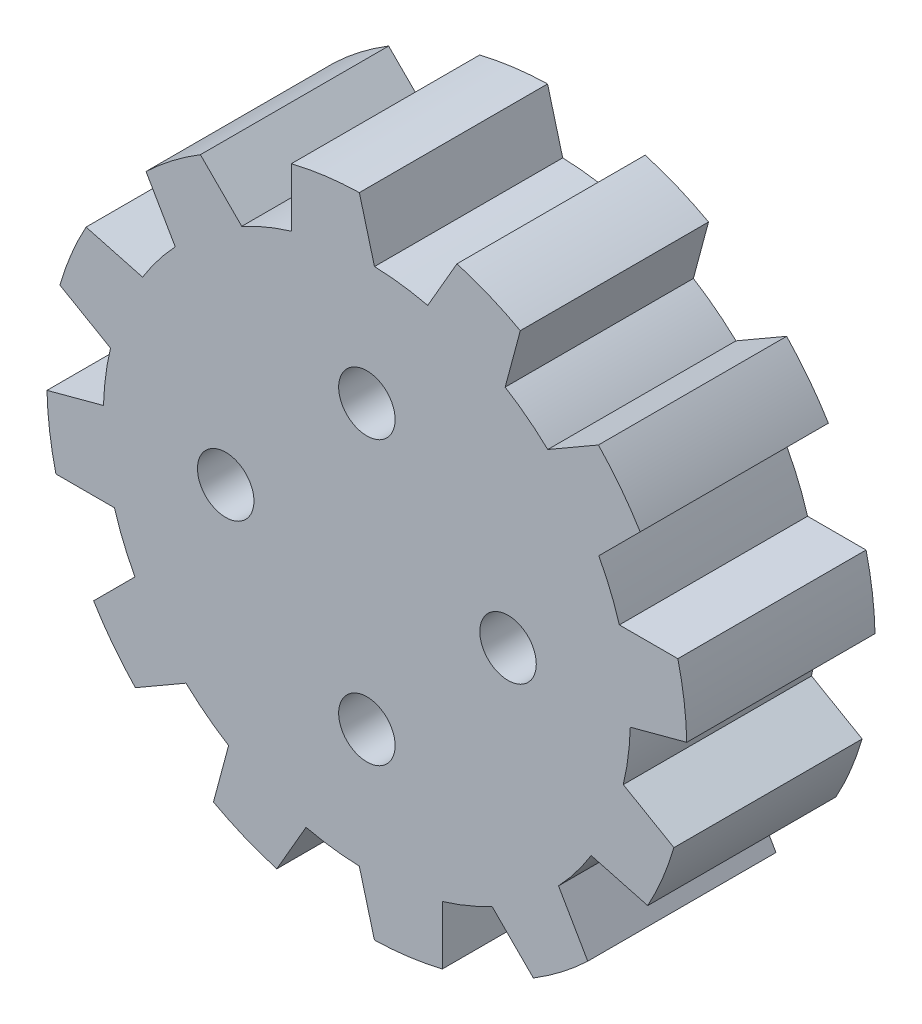
from build123d import *

# Parameters (mm, degrees)
SKETCH_1_R          = 14
EXTRUDE_2_DEPTH     = 10
SKETCH_2_R          = 10.75
CUT_EXTRUDE_1_DEPTH = 4
SKETCH_3_R          = 1.5
CUT_EXTRUDE_2_DEPTH = 10
SKETCH_4_R          = 3.75
CUT_EXTRUDE_3_DEPTH = 1


with BuildPart() as part:
    # 草圖1 → 填料-伸長2 (new body)
    with BuildSketch(Plane.XY):
        Circle(SKETCH_1_R)
        with BuildLine():
            Line((-4.011695199, 16.519875957), (-4.011695199, 13.412915478))
            ThreePointArc((-4.011695199, 13.412915478), (-1.827366691, 13.880228059), (0.403482024, 13.994184587))
            Line((0.403482024, 13.994184587), (-0.40065852, 16.995277954))
            ThreePointArc((-0.40065852, 16.995277954), (-2.218945268, 16.854562643), (-4.011695199, 16.519875957))
        make_face()
        with BuildLine():
            Line((4.785708024, 16.312479846), (3.232227785, 13.621773143))
            ThreePointArc((3.232227785, 13.621773143), (5.357568053, 12.934313455), (7.346517976, 11.917578346))
            Line((7.346517976, 11.917578346), (8.15065852, 14.918671713))
            ThreePointArc((8.15065852, 14.918671713), (6.50561835, 15.705952053), (4.785708024, 16.312479846))
        make_face()
        with BuildLine():
            Line((12.300784646, 11.734167933), (9.610077944, 10.180687694))
            ThreePointArc((9.610077944, 10.180687694), (11.106946764, 8.522660006), (12.32106037, 6.647666611))
            Line((12.32106037, 6.647666611), (14.518013193, 8.844619434))
            ThreePointArc((14.518013193, 8.844619434), (13.487006785, 10.348944293), (12.300784646, 11.734167933))
        make_face()
        with BuildLine():
            Line((16.519875957, 4.011695199), (13.412915478, 4.011695199))
            ThreePointArc((13.412915478, 4.011695199), (13.852451348, 2.027212779), (14, 0))
            ThreePointArc((14, 0), (13.998546071, -0.201761965), (13.994184587, -0.403482024))
            Line((13.994184587, -0.403482024), (16.995277954, 0.40065852))
            ThreePointArc((16.995277954, 0.40065852), (16.854562643, 2.218945268), (16.519875957, 4.011695199))
        make_face()
        with BuildLine():
            Line((16.312479846, -4.785708024), (13.621773143, -3.232227785))
            ThreePointArc((13.621773143, -3.232227785), (12.934313455, -5.357568053), (11.917578346, -7.346517976))
            Line((11.917578346, -7.346517976), (14.918671713, -8.15065852))
            ThreePointArc((14.918671713, -8.15065852), (15.705952053, -6.50561835), (16.312479846, -4.785708024))
        make_face()
        with BuildLine():
            ThreePointArc((10.180687694, -9.610077944), (8.522660006, -11.106946764), (6.647666611, -12.32106037))
            Line((6.647666611, -12.32106037), (8.844619434, -14.518013193))
            ThreePointArc((8.844619434, -14.518013193), (10.348944293, -13.487006785), (11.734167933, -12.300784646))
            Line((11.734167933, -12.300784646), (10.180687694, -9.610077944))
        make_face()
        with BuildLine():
            ThreePointArc((4.011695199, -13.412915478), (1.827366691, -13.880228059), (-0.403482024, -13.994184587))
            Line((-0.403482024, -13.994184587), (0.40065852, -16.995277954))
            ThreePointArc((0.40065852, -16.995277954), (2.218945268, -16.854562643), (4.011695199, -16.519875957))
            Line((4.011695199, -16.519875957), (4.011695199, -13.412915478))
        make_face()
        with BuildLine():
            ThreePointArc((-3.232227785, -13.621773143), (-5.357568053, -12.934313455), (-7.346517976, -11.917578346))
            Line((-7.346517976, -11.917578346), (-8.15065852, -14.918671713))
            ThreePointArc((-8.15065852, -14.918671713), (-6.50561835, -15.705952053), (-4.785708024, -16.312479846))
            Line((-4.785708024, -16.312479846), (-3.232227785, -13.621773143))
        make_face()
        with BuildLine():
            ThreePointArc((-9.610077944, -10.180687694), (-11.106946764, -8.522660006), (-12.32106037, -6.647666611))
            Line((-12.32106037, -6.647666611), (-14.518013193, -8.844619434))
            ThreePointArc((-14.518013193, -8.844619434), (-13.487006785, -10.348944293), (-12.300784646, -11.734167933))
            Line((-12.300784646, -11.734167933), (-9.610077944, -10.180687694))
        make_face()
        with BuildLine():
            ThreePointArc((-13.412915478, -4.011695199), (-13.880228059, -1.827366691), (-13.994184587, 0.403482024))
            Line((-13.994184587, 0.403482024), (-16.995277954, -0.40065852))
            ThreePointArc((-16.995277954, -0.40065852), (-16.854562643, -2.218945268), (-16.519875957, -4.011695199))
            Line((-16.519875957, -4.011695199), (-13.412915478, -4.011695199))
        make_face()
        with BuildLine():
            ThreePointArc((-13.621773143, 3.232227785), (-12.934313455, 5.357568053), (-11.917578346, 7.346517976))
            Line((-11.917578346, 7.346517976), (-14.918671713, 8.15065852))
            ThreePointArc((-14.918671713, 8.15065852), (-15.705952053, 6.50561835), (-16.312479846, 4.785708024))
            Line((-16.312479846, 4.785708024), (-13.621773143, 3.232227785))
        make_face()
        with BuildLine():
            Line((-11.734167933, 12.300784646), (-10.180687694, 9.610077944))
            ThreePointArc((-10.180687694, 9.610077944), (-8.522660006, 11.106946764), (-6.647666611, 12.32106037))
            Line((-6.647666611, 12.32106037), (-8.844619434, 14.518013193))
            ThreePointArc((-8.844619434, 14.518013193), (-10.348944293, 13.487006785), (-11.734167933, 12.300784646))
        make_face()
    extrude(amount=EXTRUDE_2_DEPTH)

    # 草圖2 → 除料-伸長1 (cut)
    with BuildSketch(Plane(origin=(0, 0, 0), x_dir=(-1, 0, 0), z_dir=(0, 0, -1))):
        Circle(SKETCH_2_R)
    extrude(amount=-CUT_EXTRUDE_1_DEPTH, mode=Mode.SUBTRACT)

    # 草圖3 → 除料-伸長2 (cut)
    with BuildSketch(Plane.XY.offset(10)):
        with Locations((-7.5, 0)):
            Circle(SKETCH_3_R)
        with Locations((7.5, 0)):
            Circle(SKETCH_3_R)
        with Locations((0, 7.5)):
            Circle(SKETCH_3_R)
        with Locations((0, -7.5)):
            Circle(SKETCH_3_R)
    extrude(amount=-CUT_EXTRUDE_2_DEPTH, mode=Mode.SUBTRACT)

    # 草圖4 → 除料-伸長3 (cut)
    with BuildSketch(Plane(origin=(0, 0, 4), x_dir=(-1, 0, 0), z_dir=(0, 0, -1))):
        Circle(SKETCH_4_R)
    extrude(amount=-CUT_EXTRUDE_3_DEPTH, mode=Mode.SUBTRACT)


solid = part.part
